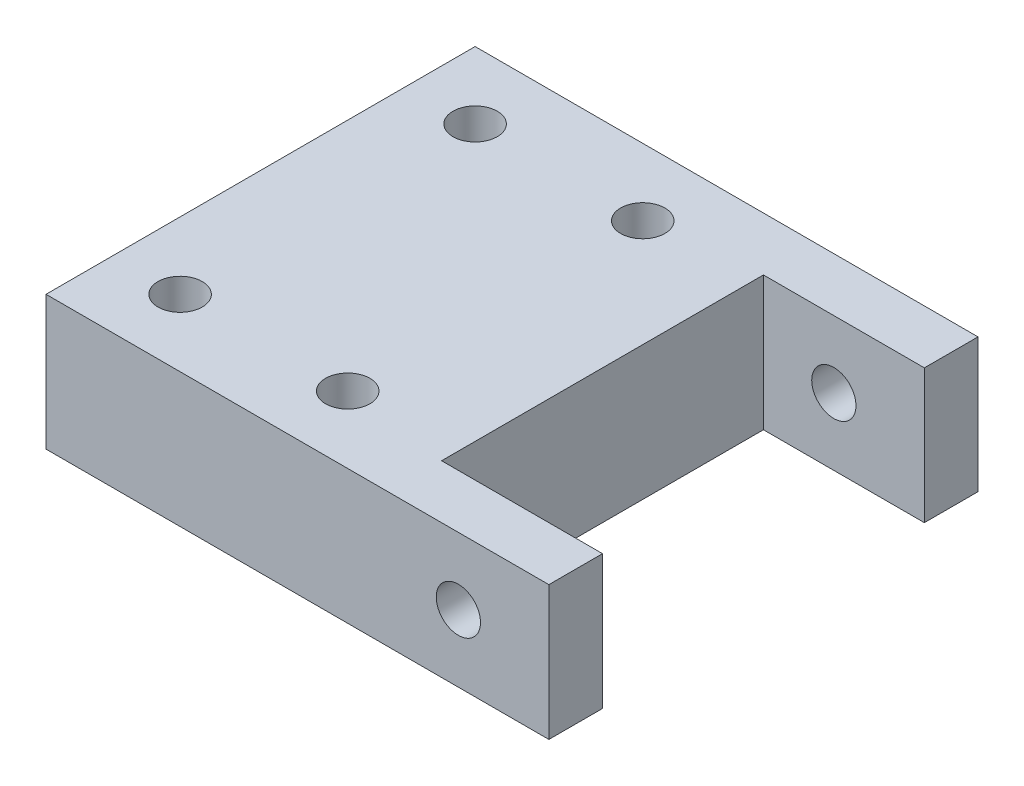
from build123d import *

# Parameters (mm, degrees)
CROQUIS2_W              = 37.5
CROQUIS2_H              = 32
SALIENTE_EXTRUIR1_DEPTH = 10
CROQUIS7_R              = 1.65
CUT_EXTRUDE_1_DEPTH     = 10
CROQUIS13_R             = 1.65
CUT_EXTRUDE_3_DEPTH     = 6
CUT_EXTRUDE_START       = -6
CUT_EXTRUDE_4_DEPTH     = 6
SKETCH_7_W              = 24
SKETCH_7_H              = 10
CUT_EXTRUDE_5_DEPTH     = 12


with BuildPart() as part:
    # Croquis2 → Saliente-Extruir1 (new body)
    with BuildSketch(Plane(origin=(0, 0, 0), x_dir=(1, 0, 0), z_dir=(0, 1, 0))):
        with Locations((17.25, 7.5)):
            Rectangle(CROQUIS2_W, CROQUIS2_H)
    extrude(amount=SALIENTE_EXTRUIR1_DEPTH)

    # Croquis7 → 切除-拉伸1 (cut)
    with BuildSketch(Plane.XZ):
        with Locations(Location((3.5, -18.5, 0), (0, 0, 270))):
            Circle(CROQUIS7_R)
        with Locations(Location((16, -18.5, 0), (0, 0, 270))):
            Circle(CROQUIS7_R)
        with Locations(Location((3.5, 3.5, 0), (0, 0, 270))):
            Circle(CROQUIS7_R)
        with Locations(Location((16, 3.5, 0), (0, 0, 270))):
            Circle(CROQUIS7_R)
    extrude(amount=-CUT_EXTRUDE_1_DEPTH, mode=Mode.SUBTRACT)

    # Croquis13 → 切除-拉伸3 (cut)
    with BuildSketch(Plane.XY.offset(8.5)):
        with Locations((29.25, 5)):
            Circle(CROQUIS13_R)
    extrude(amount=-CUT_EXTRUDE_3_DEPTH, mode=Mode.SUBTRACT)

    # 草图6 → 切除-拉伸4 (cut)
    with BuildSketch(Plane(origin=(0, 0, -23.5), x_dir=(-1, 0, 0), z_dir=(0, 0, -1)).offset(CUT_EXTRUDE_START)):
        with BuildLine():
            ThreePointArc((-27.6, 5), (-28.083273811, 6.166726189), (-29.25, 6.65))
            Line((-29.25, 6.65), (-29.25, 3.35))
            ThreePointArc((-29.25, 3.35), (-28.083273811, 3.833273811), (-27.6, 5))
        make_face()
        with BuildLine():
            Line((-29.25, 3.35), (-29.25, 6.65))
            ThreePointArc((-29.25, 6.65), (-30.9, 5), (-29.25, 3.35))
        make_face()
    extrude(amount=CUT_EXTRUDE_4_DEPTH, mode=Mode.SUBTRACT)

    # 草图7 → 切除-拉伸5 (cut)
    with BuildSketch(Plane(origin=(36, 0, 0), x_dir=(0, 0, -1), z_dir=(1, 0, 0))):
        with Locations((7.5, 5)):
            Rectangle(SKETCH_7_W, SKETCH_7_H)
    extrude(amount=-CUT_EXTRUDE_5_DEPTH, mode=Mode.SUBTRACT)


solid = part.part
